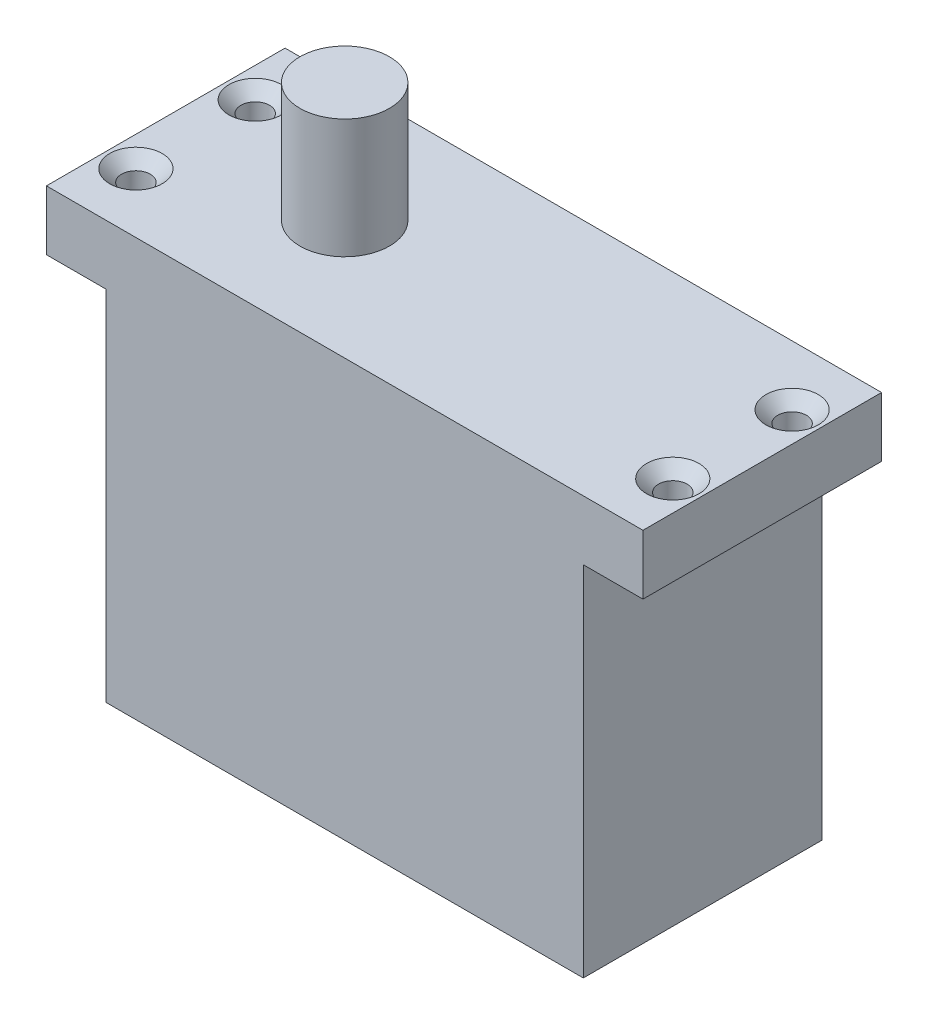
from build123d import *

# Parameters (mm, degrees)
SKETCH1_W                                       = 40
SKETCH1_H                                       = 20
BOSS_EXTRUDE1_DEPTH                             = 35
SKETCH2_W                                       = 5
SKETCH2_H                                       = 20
BOSS_EXTRUDE2_DEPTH                             = 5
SKETCH3_R                                       = 3.75
BOSS_EXTRUDE3_DEPTH                             = 10
CSK_FOR_M2_FLAT_HEAD_MACHINE_SCREW2_D           = 2.4
CSK_FOR_M2_FLAT_HEAD_MACHINE_SCREW2_CSINK_D     = 4.4
CSK_FOR_M2_FLAT_HEAD_MACHINE_SCREW2_CSINK_ANGLE = 90


with BuildPart() as part:
    # Sketch1 → Boss-Extrude1 (new body)
    with BuildSketch(Plane(origin=(0, 0, 0), x_dir=(1, 0, 0), z_dir=(0, 1, 0))):
        Rectangle(SKETCH1_W, SKETCH1_H)
    extrude(amount=BOSS_EXTRUDE1_DEPTH)

    # Sketch2 → Boss-Extrude2 (add)
    with BuildSketch(Plane(origin=(0, 35, 0), x_dir=(1, 0, 0), z_dir=(0, 1, 0))):
        with Locations((-22.5, 0)):
            Rectangle(SKETCH2_W, SKETCH2_H)
        with Locations((22.5, 0)):
            Rectangle(SKETCH2_W, SKETCH2_H)
    extrude(amount=-BOSS_EXTRUDE2_DEPTH)

    # Sketch3 → Boss-Extrude3 (add)
    with BuildSketch(Plane(origin=(0, 35, 0), x_dir=(1, 0, 0), z_dir=(0, 1, 0))):
        with Locations(Location((-10, 0, 0), (0, 0, 270))):
            Circle(SKETCH3_R)
    extrude(amount=BOSS_EXTRUDE3_DEPTH)

    # CSK for M2 Flat Head Machine Screw2 (through all)
    with Locations(Plane(origin=(0, 35, 0), x_dir=(1, 0, 0), z_dir=(0, 1, 0))):
        with Locations((22.5, -5), (22.5, 5)):
            csk_for_m2_flat_head_machine_screw2 = CounterSinkHole(CSK_FOR_M2_FLAT_HEAD_MACHINE_SCREW2_D / 2, CSK_FOR_M2_FLAT_HEAD_MACHINE_SCREW2_CSINK_D / 2, counter_sink_angle=CSK_FOR_M2_FLAT_HEAD_MACHINE_SCREW2_CSINK_ANGLE)

    # Mirror1: CSK for M2 Flat Head Machine Screw2 across plane
    add(csk_for_m2_flat_head_machine_screw2.mirror(Plane(origin=(0, 0, 0), x_dir=(0, 0, 1), z_dir=(1, 0, 0))), mode=Mode.SUBTRACT)


solid = part.part
